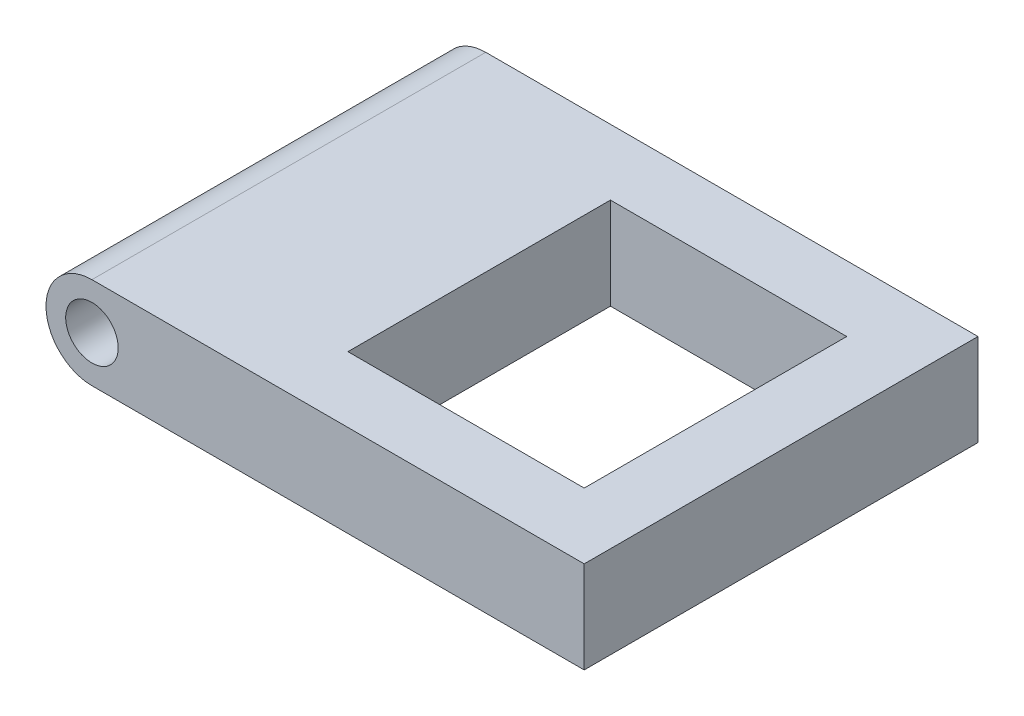
from build123d import *

# Parameters (mm, degrees)
SKETCH_1_W      = 55
SKETCH_1_H      = 60
SKETCH_1_W_2    = 36
SKETCH_1_H_2    = 40
EXTRUDE_1_DEPTH = 14
SKETCH_2_R      = 4
EXTRUDE_2_DEPTH = 60


with BuildPart() as part:
    # 草图1 → 凸台-拉伸1 (new body)
    with BuildSketch(Plane(origin=(0, 0, 0), x_dir=(1, 0, 0), z_dir=(0, 1, 0))):
        with Locations((27.5, 30)):
            Rectangle(SKETCH_1_W, SKETCH_1_H)
        with Locations((27, 30)):
            Rectangle(SKETCH_1_W_2, SKETCH_1_H_2, mode=Mode.SUBTRACT)
    extrude(amount=EXTRUDE_1_DEPTH)

    # 草图2 → 凸台-拉伸2 (add)
    with BuildSketch(Plane.XY):
        with BuildLine():
            Line((0, 0), (-20, 0))
            ThreePointArc((-20, 0), (-27, 7), (-20, 14))
            Line((-20, 14), (0, 14))
            Line((0, 14), (0, 0))
        make_face()
        with Locations((-20, 7)):
            Circle(SKETCH_2_R, mode=Mode.SUBTRACT)
    extrude(amount=-EXTRUDE_2_DEPTH)


solid = part.part
